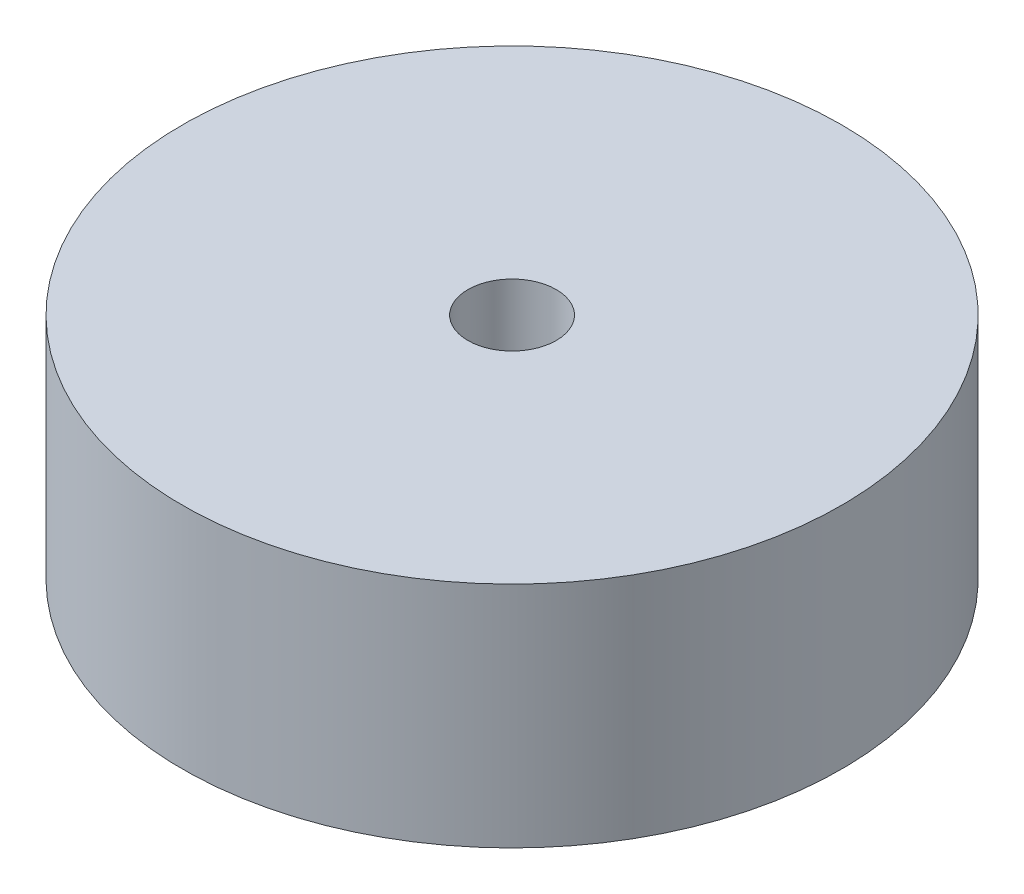
from build123d import *

# Parameters (mm, degrees)
SKETCH1_R                   = 19.05
BOSS_EXTRUDE1_DEPTH         = 13.208
F_1_4_20_TAPPED_HOLE1_D     = 5.1054
F_1_4_20_TAPPED_HOLE1_DEPTH = 16.51
F_1_4_20_TAPPED_HOLE1_TIP   = 1.533816902


with BuildPart() as part:
    # Sketch1 → Boss-Extrude1 (new body)
    with BuildSketch(Plane(origin=(0, 0, 0), x_dir=(1, 0, 0), z_dir=(0, 1, 0))):
        with Locations(Location((0, 0, 0), (0, 0, 90))):
            Circle(SKETCH1_R)
    extrude(amount=BOSS_EXTRUDE1_DEPTH)

    # 1/4-20 Tapped Hole1
    with Locations(Plane(origin=(0, 0, 0), x_dir=(-1, 0, 0), z_dir=(0, -1, 0))):
        with Locations((0, 0)):
            Hole(F_1_4_20_TAPPED_HOLE1_D / 2, depth=F_1_4_20_TAPPED_HOLE1_DEPTH)
            with Locations((0, 0, -(F_1_4_20_TAPPED_HOLE1_DEPTH + F_1_4_20_TAPPED_HOLE1_TIP / 2))):  # 118° drill point
                Cone(0, F_1_4_20_TAPPED_HOLE1_D / 2, F_1_4_20_TAPPED_HOLE1_TIP, mode=Mode.SUBTRACT)


solid = part.part
